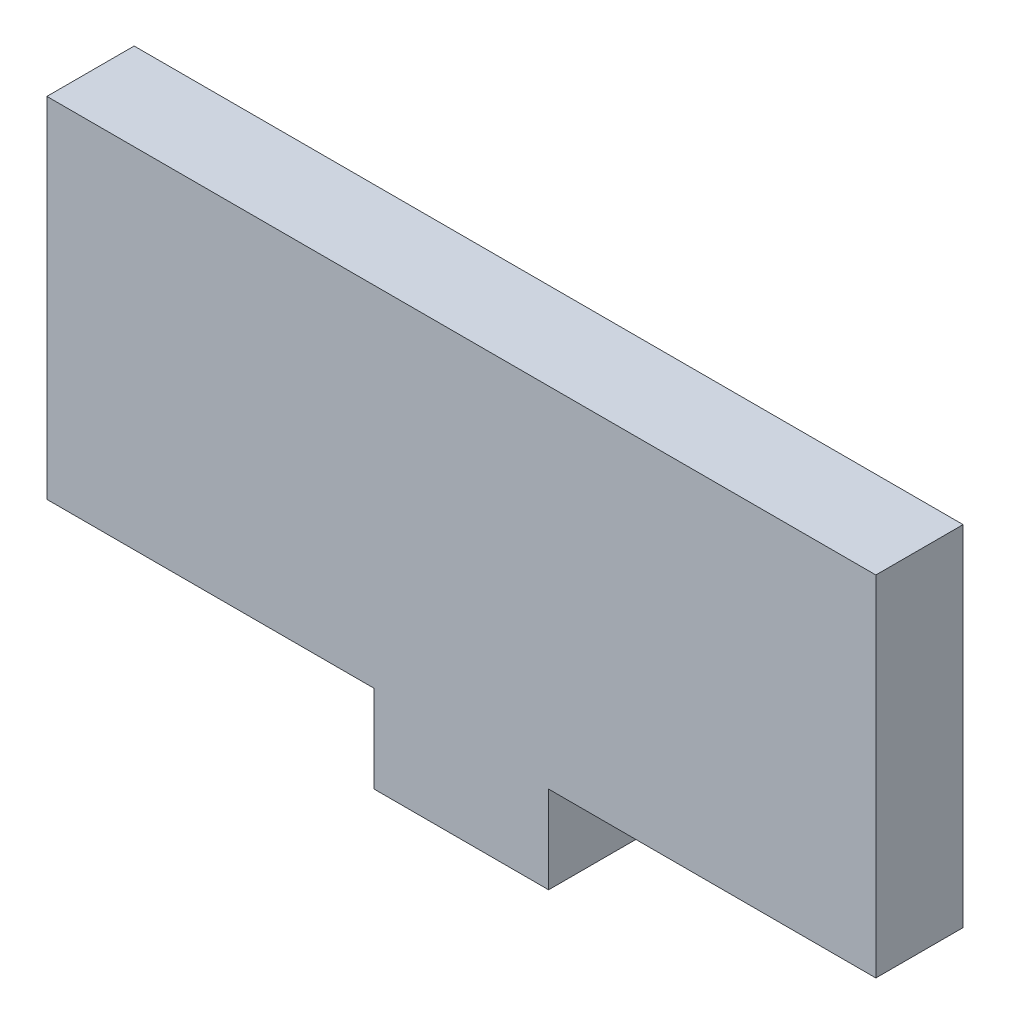
from build123d import *

# Parameters (mm, degrees)
SKETCH2_W           = 12.7
SKETCH2_H           = 6.35
SKETCH2_W_2         = 60.325
SKETCH2_H_2         = 25.4
BOSS_EXTRUDE1_DEPTH = 6.35


with BuildPart() as part:
    # Sketch2 → Boss-Extrude1 (new body)
    with BuildSketch(Plane.XY):
        with Locations((30.1625, -3.175)):
            Rectangle(SKETCH2_W, SKETCH2_H)
        with Locations((30.1625, 12.7)):
            Rectangle(SKETCH2_W_2, SKETCH2_H_2)
    extrude(amount=BOSS_EXTRUDE1_DEPTH)


solid = part.part
